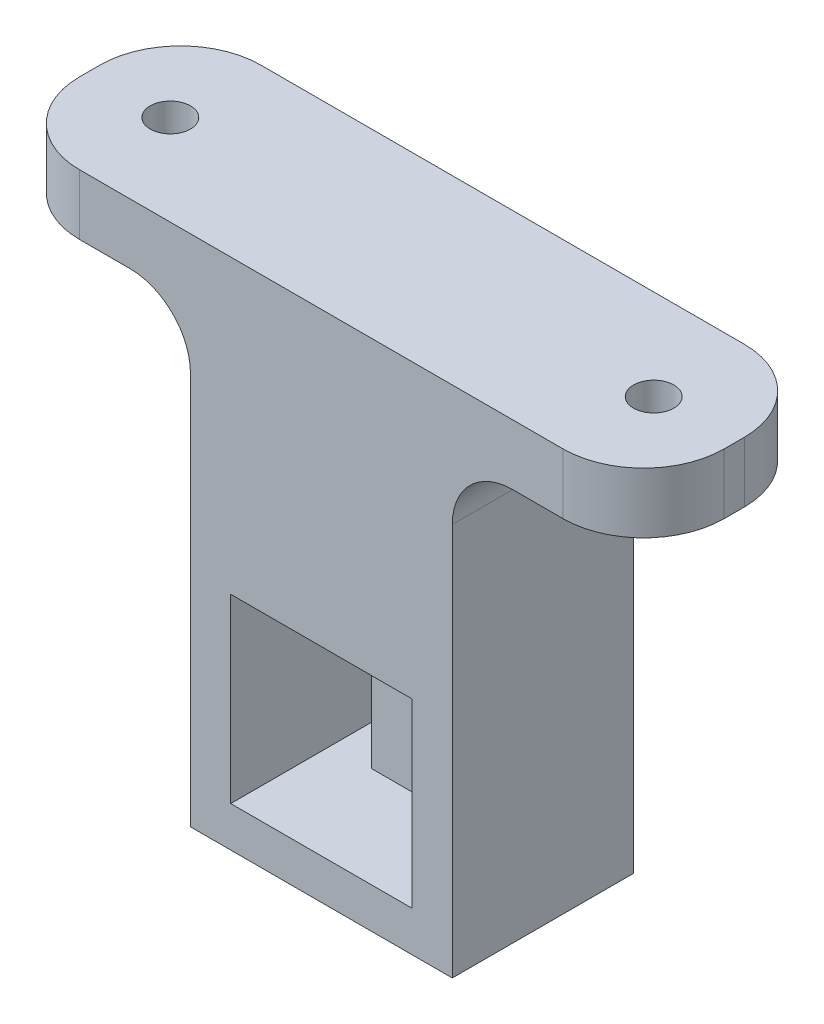
from build123d import *

# Parameters (mm, degrees)
SKETCH1_W           = 13
SKETCH1_H           = 13
SKETCH1_W_2         = 5
SKETCH1_H_2         = 9
BOSS_EXTRUDE1_DEPTH = 4
SKETCH2_W           = 13
SKETCH2_H           = 13
SKETCH2_W_2         = 9
SKETCH2_H_2         = 9
BOSS_EXTRUDE2_DEPTH = 5
SKETCH3_W           = 13
SKETCH3_H           = 9
BOSS_EXTRUDE3_DEPTH = 12.5
BOSS_EXTRUDE4_DEPTH = 3
FILLET1_R           = 3
SKETCH5_R           = 1
CUT_EXTRUDE1_DEPTH  = 44.797830997


with BuildPart() as part:
    # Sketch1 → Boss-Extrude1 (new body)
    # profile 1 of 2: a face of its own
    with BuildSketch(Plane(origin=(0, 0, -30), x_dir=(-1, 0, 0), z_dir=(0, 0, -1))):
        with Locations((0, 6)):
            Rectangle(SKETCH1_W, SKETCH1_H)
        Polygon((-4.5, 10.5), (-2.5, 10.5), (2.5, 10.5), (4.5, 10.5), (4.5, 1.5), (2.5, 1.5), (-2.5, 1.5), (-4.5, 1.5), align=None, mode=Mode.SUBTRACT)
    # profile 2 of 2: a face of its own
    with BuildSketch(Plane(origin=(0, 0, -30), x_dir=(-1, 0, 0), z_dir=(0, 0, -1))):
        with Locations((0, 6)):
            Rectangle(SKETCH1_W_2, SKETCH1_H_2)
    extrude(amount=BOSS_EXTRUDE1_DEPTH)

    # Sketch2 → Boss-Extrude2 (add)
    with BuildSketch(Plane.XY.offset(-30)):
        with Locations((0, 6)):
            Rectangle(SKETCH2_W, SKETCH2_H)
        with Locations((0, 6)):
            Rectangle(SKETCH2_W_2, SKETCH2_H_2, mode=Mode.SUBTRACT)
    extrude(amount=BOSS_EXTRUDE2_DEPTH)

    # Sketch3 → Boss-Extrude3 (add)
    with BuildSketch(Plane(origin=(0, 12.5, 0), x_dir=(1, 0, 0), z_dir=(0, 1, 0))):
        with Locations((0, 29.5)):
            Rectangle(SKETCH3_W, SKETCH3_H)
    extrude(amount=BOSS_EXTRUDE3_DEPTH)

    # Sketch4 → Boss-Extrude4 (add)
    with BuildSketch(Plane(origin=(0, 25, 0), x_dir=(1, 0, 0), z_dir=(0, 1, 0))):
        with BuildLine():
            Line((-12, 25), (12, 25))
            ThreePointArc((12, 25), (14.828427125, 26.171572875), (16, 29))
            Line((16, 29), (16, 30))
            ThreePointArc((16, 30), (14.828427125, 32.828427125), (12, 34))
            Line((12, 34), (-12, 34))
            ThreePointArc((-12, 34), (-14.828427125, 32.828427125), (-16, 30))
            Line((-16, 30), (-16, 29))
            ThreePointArc((-16, 29), (-14.828427125, 26.171572875), (-12, 25))
        make_face()
    extrude(amount=-BOSS_EXTRUDE4_DEPTH)

    # Fillet1
    fillet1_edges = [part.edges().sort_by_distance(p)[0] for p in [
        (-6.5, 22, -29.5),
        (6.5, 22, -29.5),
    ]]
    fillet(fillet1_edges, radius=FILLET1_R)

    # Sketch5 → Cut-Extrude1 (cut, through all)
    with BuildSketch(Plane.XZ.offset(-22)):
        with Locations((-12, -29.5)):
            Circle(SKETCH5_R)
        with Locations((12, -29.5)):
            Circle(SKETCH5_R)
    extrude(amount=-CUT_EXTRUDE1_DEPTH, mode=Mode.SUBTRACT)


solid = part.part
